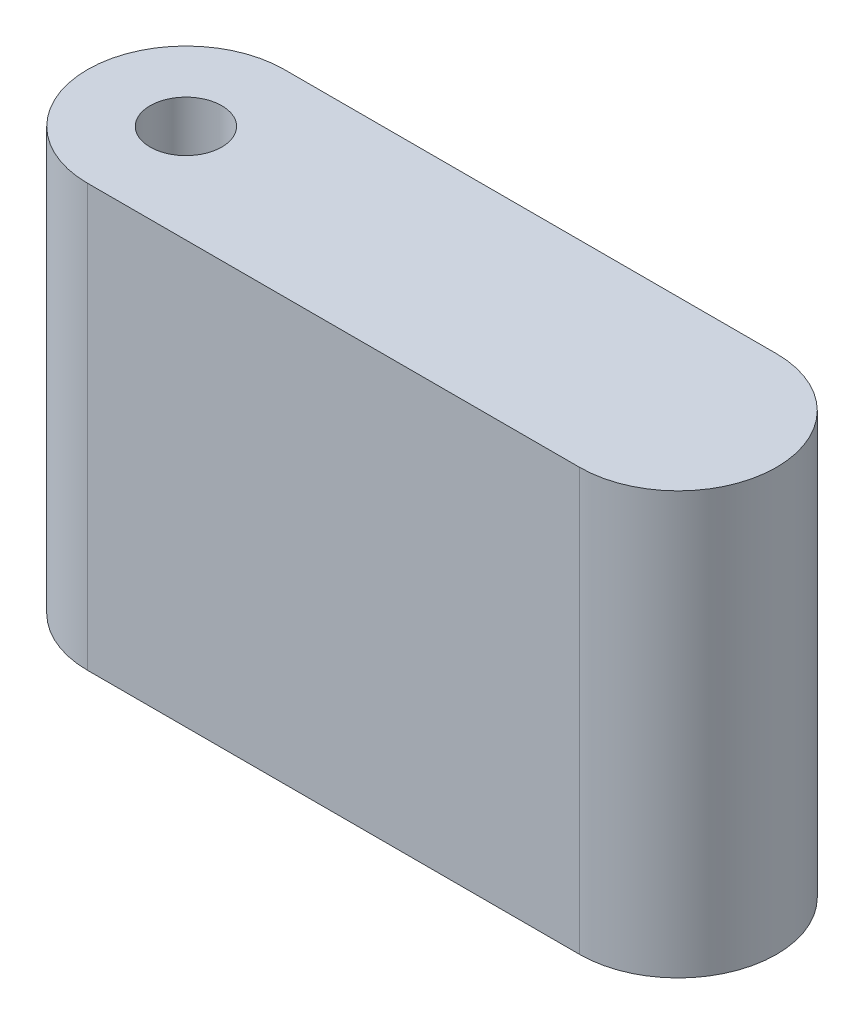
from build123d import *

# Parameters (mm, degrees)
AUFSATZ_LINEAR_AUSTRAGEN1_DEPTH      = 15
AUFSATZ_LINEAR_AUSTRAGEN1_DEPTH_BACK = 15
SKIZZE1_R                            = 2.55


with BuildPart() as part:
    # Skizze1 → Aufsatz-Linear austragen1 (new, two sides: drawn at the far end of the back side and taken through both)
    with BuildSketch(Plane(origin=(0, 0, 0), x_dir=(1, 0, 0), z_dir=(0, 1, 0)).offset(-AUFSATZ_LINEAR_AUSTRAGEN1_DEPTH_BACK)):
        with BuildLine():
            Line((0, 7), (35, 7))
            ThreePointArc((35, 7), (42, 0), (35, -7))
            Line((35, -7), (0, -7))
            ThreePointArc((0, -7), (-7, 0), (0, 7))
        make_face()
        Circle(SKIZZE1_R, mode=Mode.SUBTRACT)
    extrude(amount=AUFSATZ_LINEAR_AUSTRAGEN1_DEPTH + AUFSATZ_LINEAR_AUSTRAGEN1_DEPTH_BACK)


solid = part.part
